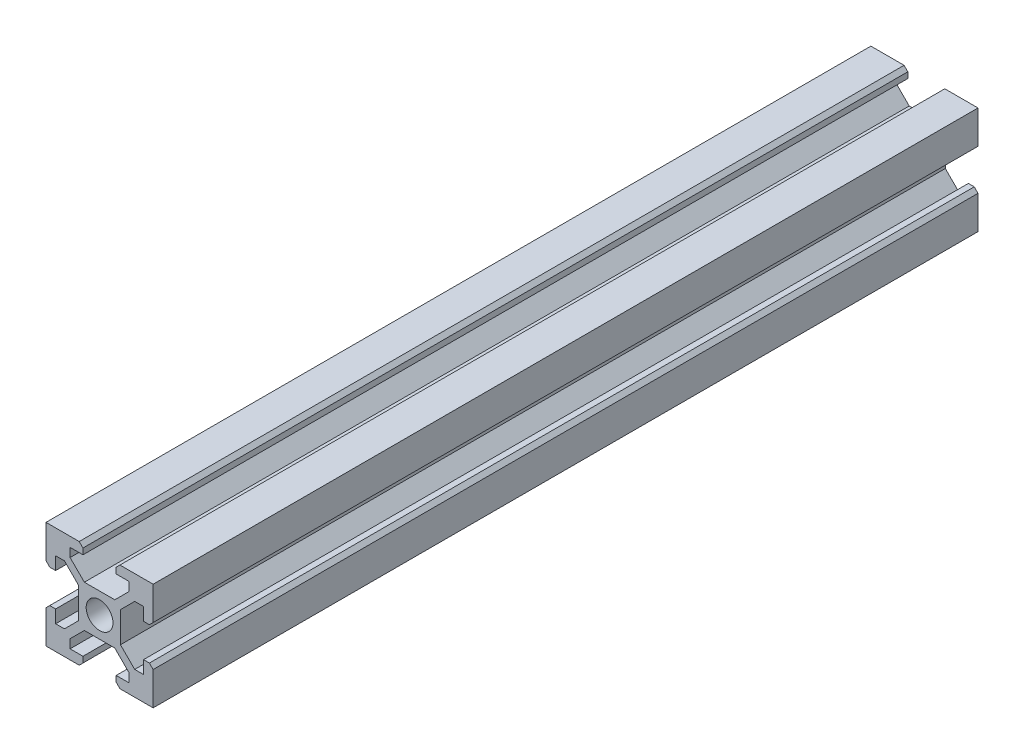
from build123d import *

# Parameters (mm, degrees)
SKETCH1_R           = 2.5
BOSS_EXTRUDE1_DEPTH = 77


with BuildPart() as part:
    # Sketch1 → Boss-Extrude1 (new, symmetric)
    with BuildSketch(Plane.XY):
        Polygon((3.9, -2.839339828), (6.560660172, -5.5), (8.200660172, -5.5), (8.200660172, -3.1), (9.3, -3.1), (10, -3.8), (10, -10), (3.8, -10), (3.1, -9.3), (3.1, -8.200660172), (5.5, -8.200660172), (5.5, -6.560660172), (2.839339828, -3.9), (-2.839339828, -3.9), (-5.5, -6.560660172), (-5.5, -8.200660172), (-3.1, -8.200660172), (-3.1, -9.3), (-3.8, -10), (-10, -10), (-10, -3.8), (-9.3, -3.1), (-8.200660172, -3.1), (-8.200660172, -5.5), (-6.560660172, -5.5), (-3.9, -2.839339828), (-3.9, 2.839339828), (-6.560660172, 5.5), (-8.200660172, 5.5), (-8.200660172, 3.1), (-9.3, 3.1), (-10, 3.8), (-10, 10), (-3.8, 10), (-3.1, 9.3), (-3.1, 8.200660172), (-5.5, 8.200660172), (-5.5, 6.560660172), (-2.839339828, 3.9), (2.839339828, 3.9), (5.5, 6.560660172), (5.5, 8.200660172), (3.1, 8.200660172), (3.1, 9.3), (3.8, 10), (10, 10), (10, 3.8), (9.3, 3.1), (8.200660172, 3.1), (8.200660172, 5.5), (6.560660172, 5.5), (3.9, 2.839339828), align=None)
        Circle(SKETCH1_R, mode=Mode.SUBTRACT)
    extrude(amount=BOSS_EXTRUDE1_DEPTH, both=True)


solid = part.part
